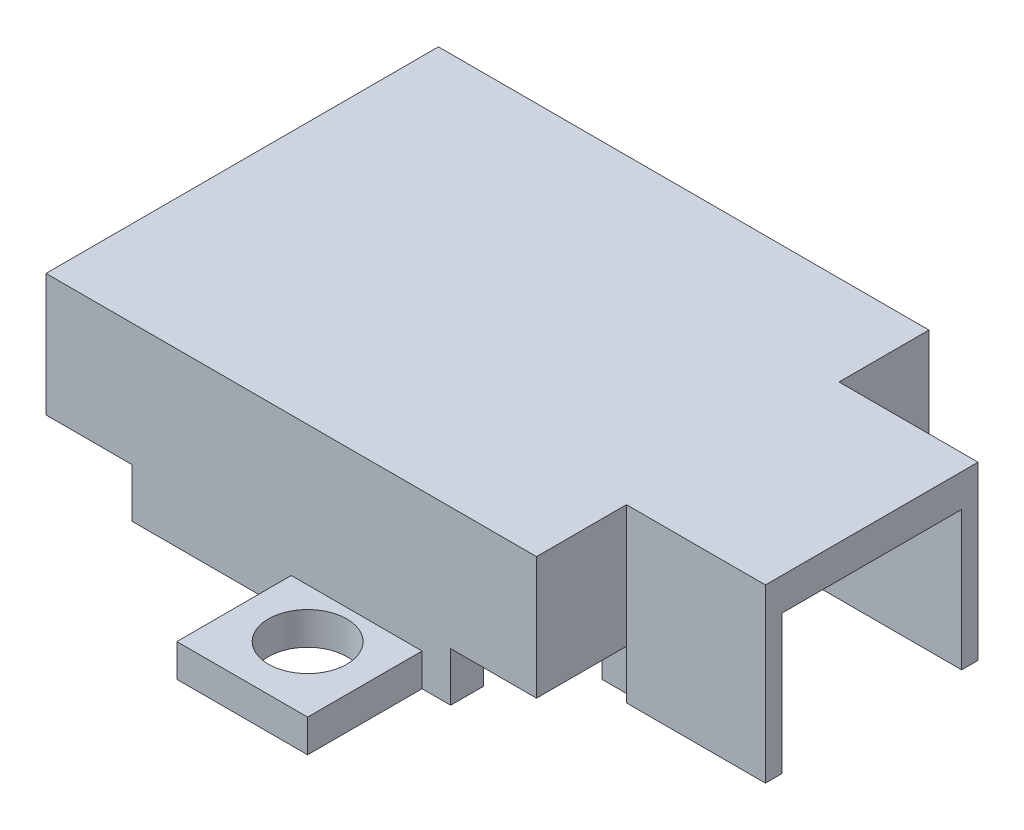
from build123d import *

# Parameters (mm, degrees)
SKETCH_1_W          = 30
SKETCH_1_H          = 24
EXTRUDE_1_DEPTH     = 2
SKETCH_2_W          = 19.5
SKETCH_2_H          = 2
SKETCH_2_W_2        = 2
SKETCH_2_H_2        = 0.5
SKETCH_2_H_3        = 12
EXTRUDE_2_DEPTH     = 5.5
SKETCH_3_W          = 19.5
SKETCH_3_H          = 2
SKETCH_3_W_2        = 2
SKETCH_3_H_2        = 0.5
EXTRUDE_3_DEPTH     = 3
SKETCH_4_W          = 8.5
SKETCH_4_H          = 13
EXTRUDE_4_DEPTH     = 2
SKETCH_5_W          = 8.5
SKETCH_5_H          = 1
EXTRUDE_5_DEPTH     = 8.5
SKETCH_6_W          = 8
SKETCH_6_H          = 7
SKETCH_6_R          = 2.4
EXTRUDE_6_DEPTH     = 2
SKETCH_7_W          = 3.25
SKETCH_7_H          = 3
CUT_EXTRUDE_1_DEPTH = 5.5


with BuildPart() as part:
    # 草图1 → 凸台-拉伸1 (new body)
    with BuildSketch(Plane(origin=(0, 0, 0), x_dir=(1, 0, 0), z_dir=(0, 1, 0))):
        Rectangle(SKETCH_1_W, SKETCH_1_H)
    extrude(amount=EXTRUDE_1_DEPTH)

    # 草图2 → 凸台-拉伸2 (add)
    with BuildSketch(Plane.XZ):
        Polygon((-9.75, 12), (-15, 12), (-15, 6), (-13, 6), (-9.75, 6), (-9.75, 10), align=None)
        with Locations((0, 11)):
            Rectangle(SKETCH_2_W, SKETCH_2_H)
        Polygon((15, 12), (9.75, 12), (9.75, 10), (9.75, 6), (13, 6), (15, 6), align=None)
        with Locations((14, 5.75)):
            Rectangle(SKETCH_2_W_2, SKETCH_2_H_2)
        with Locations((14, -5.75)):
            Rectangle(SKETCH_2_W_2, SKETCH_2_H_2)
        Polygon((9.75, -10), (9.75, -12), (15, -12), (15, -6), (13, -6), (9.75, -6), align=None)
        with Locations((0, -11)):
            Rectangle(SKETCH_2_W, SKETCH_2_H)
        Polygon((-13, -6), (-15, -6), (-15, -12), (-9.75, -12), (-9.75, -10), (-9.75, -6), align=None)
        with Locations((-14, 0)):
            Rectangle(SKETCH_2_W_2, SKETCH_2_H_3)
    extrude(amount=EXTRUDE_2_DEPTH)

    # 草图3 → 凸台-拉伸3 (add)
    with BuildSketch(Plane.XZ.offset(5.5)):
        with Locations((0, 11)):
            Rectangle(SKETCH_3_W, SKETCH_3_H)
        with Locations((0, -11)):
            Rectangle(SKETCH_3_W, SKETCH_3_H)
        with Locations((14, -5.75)):
            Rectangle(SKETCH_3_W_2, SKETCH_3_H_2)
        with Locations((14, 5.75)):
            Rectangle(SKETCH_3_W_2, SKETCH_3_H_2)
    extrude(amount=EXTRUDE_3_DEPTH)

    # 草图4 → 凸台-拉伸4 (add)
    with BuildSketch(Plane(origin=(0, 2, 0), x_dir=(1, 0, 0), z_dir=(0, 1, 0))):
        with Locations((19.25, 0)):
            Rectangle(SKETCH_4_W, SKETCH_4_H)
    extrude(amount=-EXTRUDE_4_DEPTH)

    # 草图5 → 凸台-拉伸5 (add)
    with BuildSketch(Plane.XZ):
        with Locations((19.25, 6)):
            Rectangle(SKETCH_5_W, SKETCH_5_H)
        with Locations((19.25, -6)):
            Rectangle(SKETCH_5_W, SKETCH_5_H)
    extrude(amount=EXTRUDE_5_DEPTH)

    # 草图6 → 凸台-拉伸6 (add)
    # profile 1 of 2: a face of its own
    with BuildSketch(Plane.XZ.offset(8.5)):
        with Locations((4, 15.5)):
            Rectangle(SKETCH_6_W, SKETCH_6_H)
        with Locations(Location((4, 15, 0), (0, 0, 270))):
            Circle(SKETCH_6_R, mode=Mode.SUBTRACT)
    # profile 2 of 2: a face of its own
    with BuildSketch(Plane.XZ.offset(8.5)):
        with Locations((4, -15.5)):
            Rectangle(SKETCH_6_W, SKETCH_6_H)
        with Locations(Location((4, -15, 0), (0, 0, 90))):
            Circle(SKETCH_6_R, mode=Mode.SUBTRACT)
    extrude(amount=-EXTRUDE_6_DEPTH)

    # 草图7 → 切除-拉伸1 (cut)
    with BuildSketch(Plane.XZ.offset(5.5)):
        with Locations((-11.375, 7.5)):
            Rectangle(SKETCH_7_W, SKETCH_7_H)
    extrude(amount=-CUT_EXTRUDE_1_DEPTH, mode=Mode.SUBTRACT)


solid = part.part
